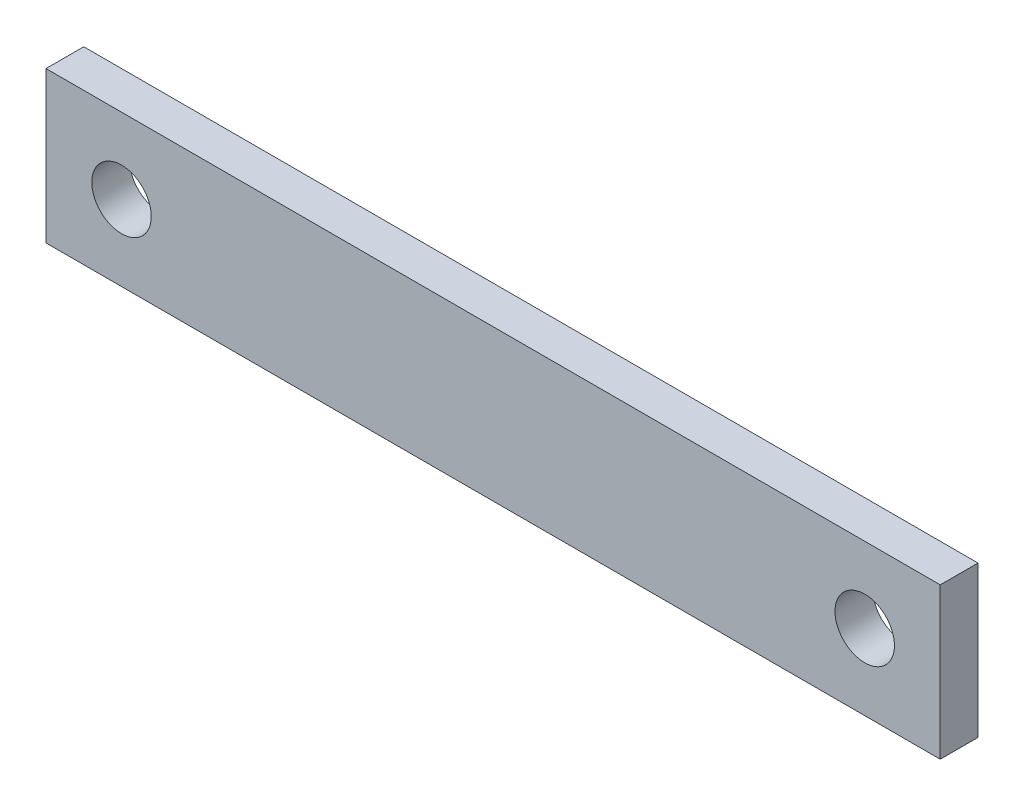
from build123d import *

# Parameters (mm, degrees)
SKETCH2_W           = 150.368
SKETCH2_H           = 25.4
SKETCH2_R           = 5.0000027
BOSS_EXTRUDE1_DEPTH = 6.35


with BuildPart() as part:
    # Sketch2 → Boss-Extrude1 (new body)
    with BuildSketch(Plane.XY):
        with Locations((75.184, 12.7)):
            Rectangle(SKETCH2_W, SKETCH2_H)
        with Locations((137.668, 12.7)):
            Circle(SKETCH2_R, mode=Mode.SUBTRACT)
        with Locations((12.7, 12.7)):
            Circle(SKETCH2_R, mode=Mode.SUBTRACT)
    extrude(amount=-BOSS_EXTRUDE1_DEPTH)


solid = part.part
